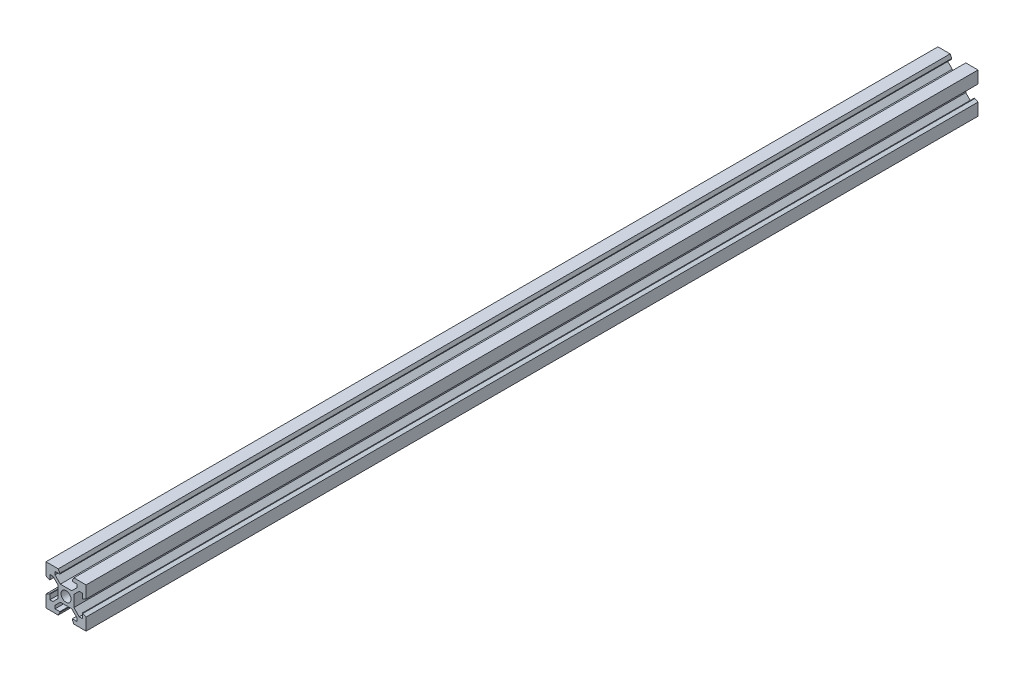
from build123d import *

# Parameters (mm, degrees)
SKETCH1_R           = 2.5
BOSS_EXTRUDE1_DEPTH = 445


with BuildPart() as part:
    # Sketch1 → Boss-Extrude1 (new body)
    with BuildSketch(Plane.XY):
        Polygon((6.1, 20), (0, 20), (0, 13.895792909), (1.56, 13.1), (1.9, 13.1), (1.9, 15.5), (3.439339828, 15.5), (6.1, 12.839339828), (6.1, 7.160660172), (3.439339828, 4.5), (1.9, 4.5), (1.9, 6.9), (1.56, 6.9), (0, 6.104207091), (0, 0), (6.1, 0), (6.9, 1.56), (6.9, 1.9), (4.5, 1.9), (4.5, 3.439339828), (7.160660172, 6.1), (12.839339828, 6.1), (15.5, 3.439339828), (15.5, 1.9), (13.1, 1.9), (13.1, 1.56), (13.9, 0), (20, 0), (20, 6.104207091), (18.44, 6.9), (18.1, 6.9), (18.1, 4.5), (16.560660172, 4.5), (13.9, 7.160660172), (13.9, 12.839339828), (16.560660172, 15.5), (18.1, 15.5), (18.1, 13.1), (18.44, 13.1), (20, 13.895792909), (20, 20), (13.9, 20), (13.1, 18.44), (13.1, 18.1), (15.5, 18.1), (15.5, 16.560660172), (12.839339828, 13.9), (7.160660172, 13.9), (4.5, 16.560660172), (4.5, 18.1), (6.9, 18.1), (6.9, 18.44), align=None)
        with Locations((10, 10)):
            Circle(SKETCH1_R, mode=Mode.SUBTRACT)
    extrude(amount=BOSS_EXTRUDE1_DEPTH)


solid = part.part
